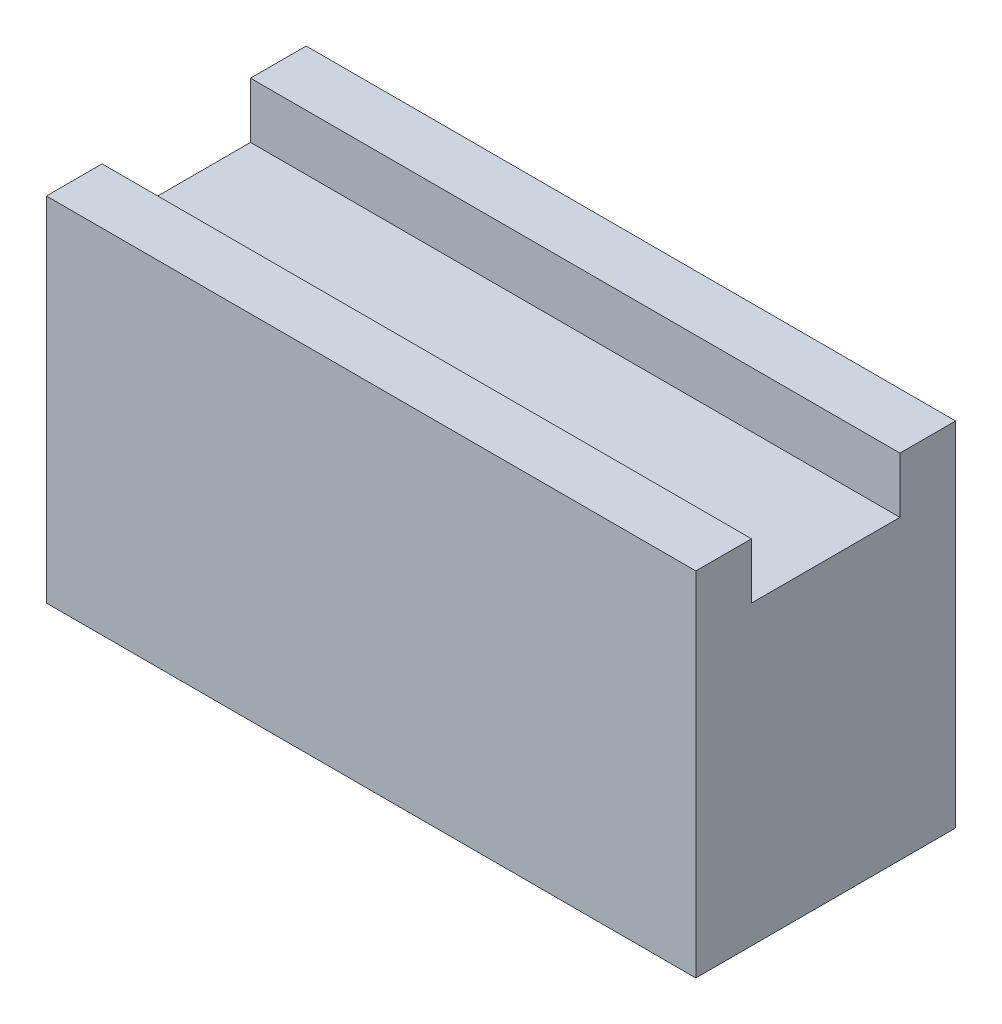
from build123d import *

# Parameters (mm, degrees)
BOSS_EXTRUDE1_DEPTH = 35


with BuildPart() as part:
    # Sketch1 → Boss-Extrude1 (new body)
    with BuildSketch(Plane(origin=(0, 0, 0), x_dir=(0, 0, -1), z_dir=(1, 0, 0))):
        Polygon((-7, 8), (-7, 11), (-4, 11), (-4, 8), (4, 8), (4, 11), (7, 11), (7, 8), (7, -8), (-7, -8), align=None)
    extrude(amount=-BOSS_EXTRUDE1_DEPTH)


solid = part.part
